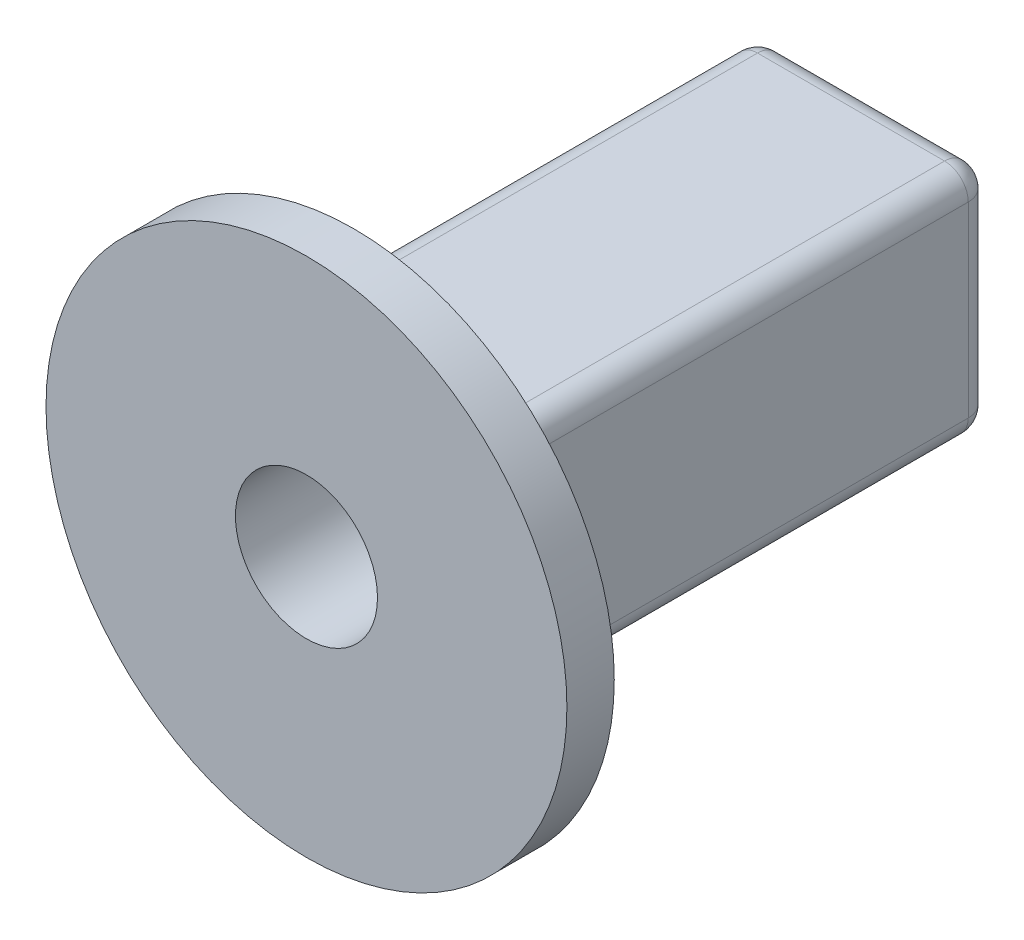
from build123d import *

# Parameters (mm, degrees)
ESQUISSE1_W      = 4.949747468
ESQUISSE1_H      = 4.949747468
EXTRUSION1_DEPTH = 11
ESQUISSE2_R      = 5.5
EXTRUSION2_DEPTH = 1
ESQUISSE3_R      = 1.5
EXTRUSION3_DEPTH = 15.300349646
CONG_1_R         = 0.5


with BuildPart() as part:
    # Esquisse1 → Extrusion1 (new body)
    with BuildSketch(Plane.XY):
        Rectangle(ESQUISSE1_W, ESQUISSE1_H)
    extrude(amount=EXTRUSION1_DEPTH)

    # Esquisse2 → Extrusion2 (add)
    with BuildSketch(Plane.XY.offset(11)):
        Circle(ESQUISSE2_R)
    extrude(amount=EXTRUSION2_DEPTH)

    # Esquisse3 → Extrusion3 (cut, through all)
    with BuildSketch(Plane.XY.offset(12)):
        Circle(ESQUISSE3_R)
    extrude(amount=-EXTRUSION3_DEPTH, mode=Mode.SUBTRACT)

    # Congé1
    cong_1_edges = [part.edges().sort_by_distance(p)[0] for p in [
        (0, 2.474873734, 0),
        (2.474873734, 0, 0),
        (0, -2.474873734, 0),
        (-2.474873734, 0, 0),
        (-2.474873734, 2.474873734, 5.5),
        (2.474873734, 2.474873734, 5.5),
        (2.474873734, -2.474873734, 5.5),
        (-2.474873734, -2.474873734, 5.5),
    ]]
    fillet(cong_1_edges, radius=CONG_1_R)


solid = part.part
